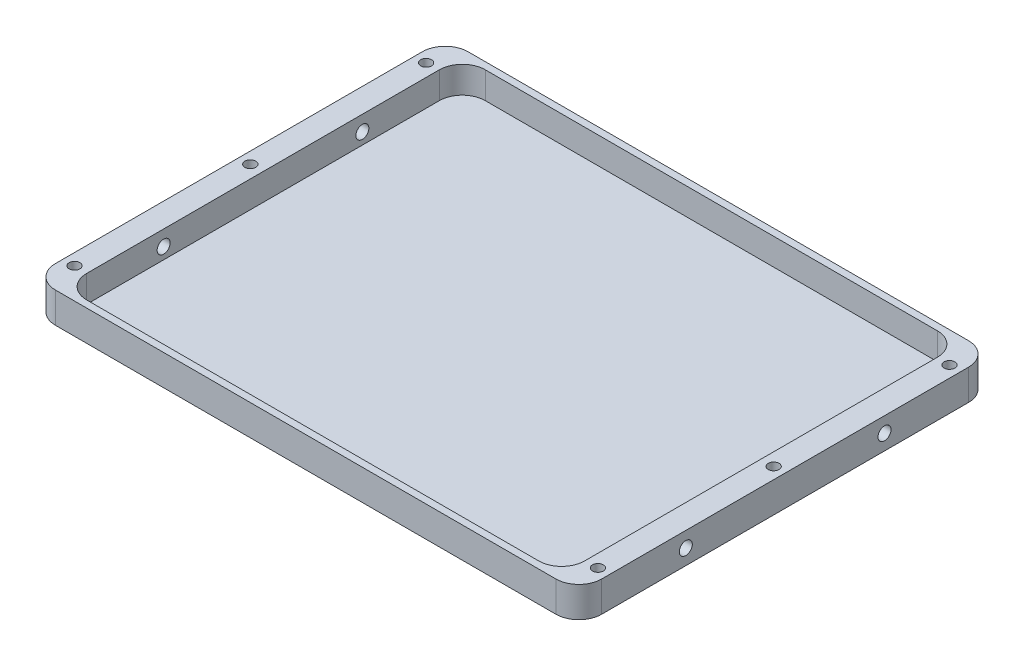
from build123d import *

# Parameters (mm, degrees)
SKETCH1_W                                         = 226.949
SKETCH1_H                                         = 171.45
BOSS_EXTRUDE1_DEPTH                               = 12.7
CUT_EXTRUDE1_DEPTH                                = 11.1125
F_1_4_28_TAPPED_HOLE1_REACH                       = 286.714
F_1_4_28_TAPPED_HOLE1_BORE_R                      = 2.7051
CSK_FOR_8_FLAT_HEAD_SOCKET_CAP_SCREW1_D           = 4.4958
CSK_FOR_8_FLAT_HEAD_SOCKET_CAP_SCREW1_CSINK_D     = 9.1186
CSK_FOR_8_FLAT_HEAD_SOCKET_CAP_SCREW1_CSINK_ANGLE = 82
FILLET1_R                                         = 9.525


with BuildPart() as part:
    # Sketch1 → Boss-Extrude1 (new body)
    with BuildSketch(Plane(origin=(0, 0, 0), x_dir=(1, 0, 0), z_dir=(0, 1, 0))):
        with Locations((113.4745, 85.725)):
            Rectangle(SKETCH1_W, SKETCH1_H)
    extrude(amount=BOSS_EXTRUDE1_DEPTH)

    # Sketch2 → Cut-Extrude1 (cut)
    with BuildSketch(Plane(origin=(0, 12.7, 0), x_dir=(1, 0, 0), z_dir=(0, 1, 0))):
        with BuildLine():
            Line((19.558, 2.921), (207.391, 2.921))
            ThreePointArc((207.391, 2.921), (214.126192091, 5.710807909), (216.916, 12.446))
            Line((216.916, 12.446), (216.916, 159.004))
            ThreePointArc((216.916, 159.004), (214.126192091, 165.739192091), (207.391, 168.529))
            Line((207.391, 168.529), (19.558, 168.529))
            ThreePointArc((19.558, 168.529), (12.822807909, 165.739192091), (10.033, 159.004))
            Line((10.033, 159.004), (10.033, 12.446))
            ThreePointArc((10.033, 12.446), (12.822807909, 5.710807909), (19.558, 2.921))
        make_face()
    extrude(amount=-CUT_EXTRUDE1_DEPTH, mode=Mode.SUBTRACT)

    # 1/4-28 Tapped Hole1 bore → 1/4-28 Tapped Hole1 (cut, up to next)
    with BuildSketch(Plane.ZY, mode=Mode.PRIVATE) as f_1_4_28_tapped_hole1_sk1:
        with Locations((-127, 6.35)):
            Circle(F_1_4_28_TAPPED_HOLE1_BORE_R)
    f_1_4_28_tapped_hole1_tool1 = extrude(f_1_4_28_tapped_hole1_sk1.sketch, amount=-F_1_4_28_TAPPED_HOLE1_REACH, mode=Mode.PRIVATE) & part.part
    # 1/4-28 Tapped Hole1 bore → 1/4-28 Tapped Hole1 (cut, up to next)
    with BuildSketch(Plane.ZY, mode=Mode.PRIVATE) as f_1_4_28_tapped_hole1_sk2:
        with Locations((-44.45, 6.35)):
            Circle(F_1_4_28_TAPPED_HOLE1_BORE_R)
    f_1_4_28_tapped_hole1_tool2 = extrude(f_1_4_28_tapped_hole1_sk2.sketch, amount=-F_1_4_28_TAPPED_HOLE1_REACH, mode=Mode.PRIVATE) & part.part
    f_1_4_28_tapped_hole1_1 = f_1_4_28_tapped_hole1_tool1.solids().sort_by_distance((0, 6.35, -127))[0]
    add(f_1_4_28_tapped_hole1_1, mode=Mode.SUBTRACT)
    f_1_4_28_tapped_hole1_2 = f_1_4_28_tapped_hole1_tool2.solids().sort_by_distance((0, 6.35, -44.45))[0]
    add(f_1_4_28_tapped_hole1_2, mode=Mode.SUBTRACT)
    f_1_4_28_tapped_hole1 = f_1_4_28_tapped_hole1_1 + f_1_4_28_tapped_hole1_2  # 1/4-28 Tapped Hole1 as one shape, for the pattern or mirror that repeats it

    # CSK for #8 Flat Head Socket Cap Screw1 (through all)
    with Locations(Plane.XZ):
        with Locations((4.7625, -12.7), (4.7625, -85.725), (4.7625, -158.75)):
            csk_for_8_flat_head_socket_cap_screw1 = CounterSinkHole(CSK_FOR_8_FLAT_HEAD_SOCKET_CAP_SCREW1_D / 2, CSK_FOR_8_FLAT_HEAD_SOCKET_CAP_SCREW1_CSINK_D / 2, counter_sink_angle=CSK_FOR_8_FLAT_HEAD_SOCKET_CAP_SCREW1_CSINK_ANGLE)

    # Mirror1: 1/4-28 Tapped Hole1, CSK for #8 Flat Head Socket Cap Screw1 across plane
    add(f_1_4_28_tapped_hole1.mirror(Plane(origin=(113.4745, 0, 0), x_dir=(0, 0, 1), z_dir=(1, 0, 0))), mode=Mode.SUBTRACT)
    add(csk_for_8_flat_head_socket_cap_screw1.mirror(Plane(origin=(113.4745, 0, 0), x_dir=(0, 0, 1), z_dir=(1, 0, 0))), mode=Mode.SUBTRACT)

    # Fillet1
    fillet1_edges = [part.edges().sort_by_distance(p)[0] for p in [
        (0, 6.35, -171.45),
        (226.949, 6.35, -171.45),
        (226.949, 6.35, 0),
        (0, 6.35, 0),
    ]]
    fillet(fillet1_edges, radius=FILLET1_R)


solid = part.part
